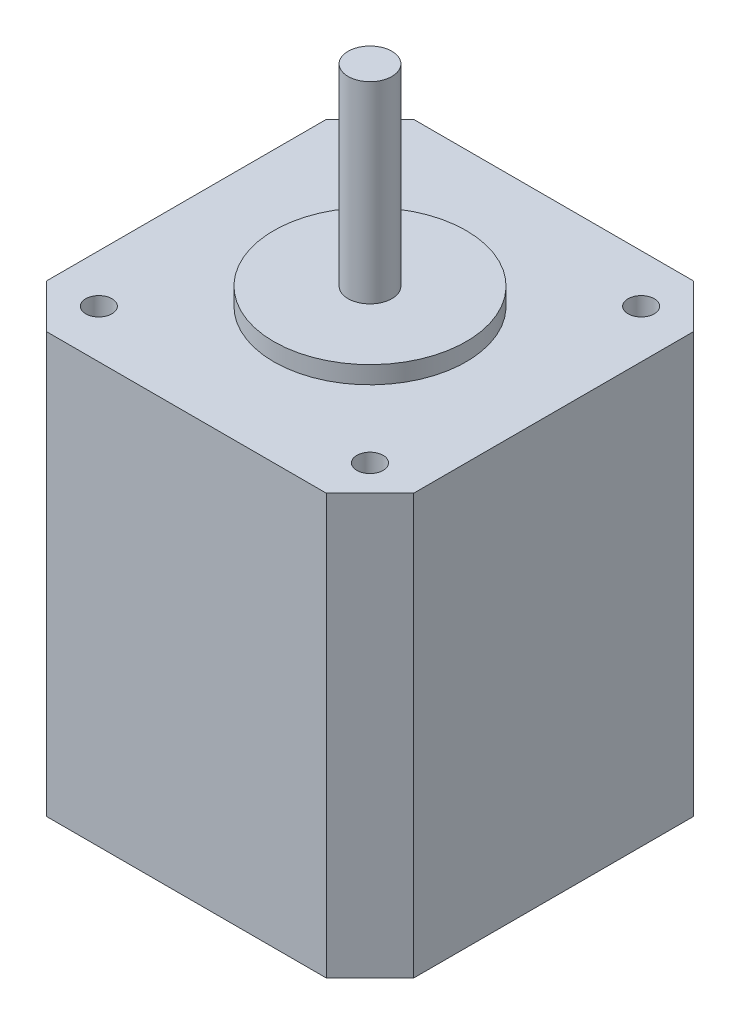
from build123d import *

# Parameters (mm, degrees)
SKETCH1_W           = 42
SKETCH1_H           = 42
BOSS_EXTRUDE1_DEPTH = 48
CHAMFER1_SIZE       = 5
SKETCH2_R           = 1.5
CUT_EXTRUDE1_DEPTH  = 4.5
SKETCH3_R           = 11
BOSS_EXTRUDE2_DEPTH = 2
SKETCH4_R           = 2.5
BOSS_EXTRUDE3_DEPTH = 22


with BuildPart() as part:
    # Sketch1 → Boss-Extrude1 (new body)
    with BuildSketch(Plane(origin=(0, 0, 0), x_dir=(1, 0, 0), z_dir=(0, 1, 0))):
        with Locations((21, 21)):
            Rectangle(SKETCH1_W, SKETCH1_H)
    extrude(amount=BOSS_EXTRUDE1_DEPTH)

    # Chamfer1
    chamfer1_edges = [part.edges().sort_by_distance(p)[0] for p in [
        (0, 24, -42),
        (42, 24, -42),
        (42, 24, 0),
        (0, 24, 0),
    ]]
    chamfer(chamfer1_edges, length=CHAMFER1_SIZE)

    # Sketch2 → Cut-Extrude1 (cut)
    with BuildSketch(Plane(origin=(0, 48, 0), x_dir=(1, 0, 0), z_dir=(0, 1, 0))):
        with Locations(Location((5.5, 36.5, 0), (0, 0, 270))):
            Circle(SKETCH2_R)
        with Locations(Location((36.5, 36.5, 0), (0, 0, 270))):
            Circle(SKETCH2_R)
        with Locations(Location((5.5, 5.5, 0), (0, 0, 270))):
            Circle(SKETCH2_R)
        with Locations(Location((36.5, 5.5, 0), (0, 0, 270))):
            Circle(SKETCH2_R)
    extrude(amount=-CUT_EXTRUDE1_DEPTH, mode=Mode.SUBTRACT)

    # Sketch3 → Boss-Extrude2 (add)
    with BuildSketch(Plane(origin=(0, 48, 0), x_dir=(1, 0, 0), z_dir=(0, 1, 0))):
        with Locations(Location((21, 21, 0), (0, 0, 90))):
            Circle(SKETCH3_R)
    extrude(amount=BOSS_EXTRUDE2_DEPTH)

    # Sketch4 → Boss-Extrude3 (add)
    with BuildSketch(Plane(origin=(0, 50, 0), x_dir=(1, 0, 0), z_dir=(0, 1, 0))):
        with Locations(Location((21, 21, 0), (0, 0, 270))):
            Circle(SKETCH4_R)
    extrude(amount=BOSS_EXTRUDE3_DEPTH)


solid = part.part
